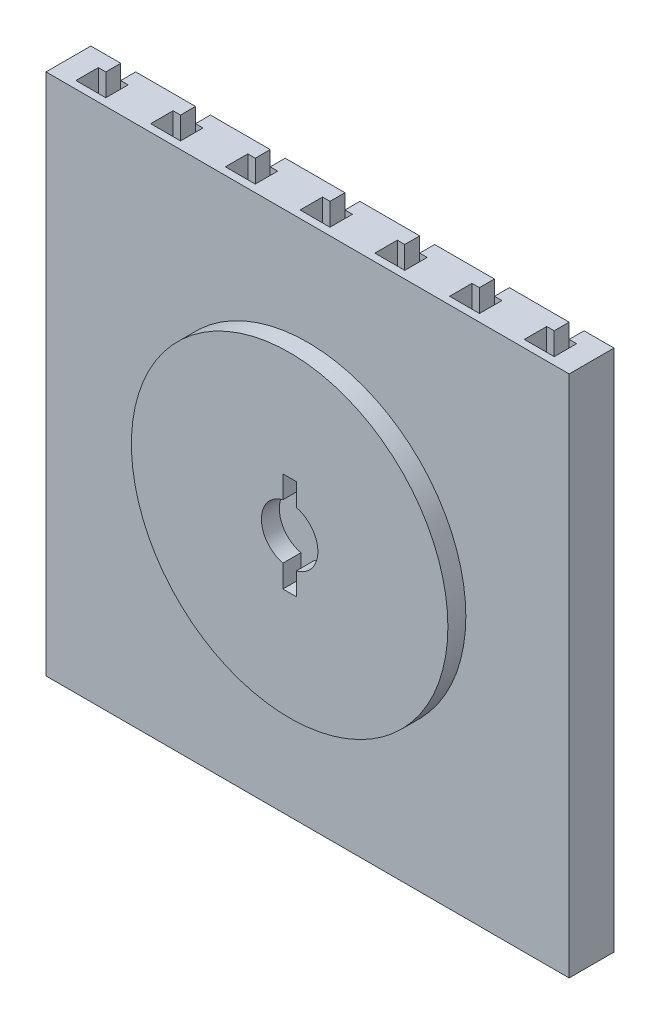
from build123d import *

# Parameters (mm, degrees)
SKETCH1_W           = 350
SKETCH1_H           = 350
BOSS_EXTRUDE1_DEPTH = 30
SKETCH2_R           = 105.873487711
BOSS_EXTRUDE2_DEPTH = 12
CUT_EXTRUDE1_DEPTH  = 12
CUT_EXTRUDE3_DEPTH  = 394.559398312


with BuildPart() as part:
    # Sketch1 → Boss-Extrude1 (new body)
    with BuildSketch(Plane.XY):
        Rectangle(SKETCH1_W, SKETCH1_H)
    extrude(amount=BOSS_EXTRUDE1_DEPTH)

    # Sketch2 → Boss-Extrude2 (add)
    with BuildSketch(Plane.XY.offset(30)):
        Circle(SKETCH2_R)
    extrude(amount=BOSS_EXTRUDE2_DEPTH)

    # Sketch3 → Cut-Extrude1 (cut)
    with BuildSketch(Plane.XY.offset(42)):
        with BuildLine():
            Line((-4.5, 18.356470249), (-4.5, 33.356470249))
            Line((-4.5, 33.356470249), (4.5, 33.356470249))
            Line((4.5, 33.356470249), (4.5, 18.356470249))
            ThreePointArc((4.5, 18.356470249), (18.9, 0), (4.5, -18.356470249))
            Line((4.5, -18.356470249), (4.5, -33.356470249))
            Line((4.5, -33.356470249), (-4.5, -33.356470249))
            Line((-4.5, -33.356470249), (-4.5, -18.356470249))
            ThreePointArc((-4.5, -18.356470249), (-18.9, 0), (-4.5, 18.356470249))
        make_face()
    extrude(amount=-CUT_EXTRUDE1_DEPTH, mode=Mode.SUBTRACT)

    # Sketch5 → Cut-Extrude3 (cut, through all)
    with BuildSketch(Plane(origin=(0, 175, 0), x_dir=(1, 0, 0), z_dir=(0, 1, 0))):
        Polygon((-145, 0), (-155, 0), (-155, -10), (-160, -10), (-160, -25), (-140, -25), (-140, -10), (-145, -10), align=None)
        Polygon((-95, 0), (-105, 0), (-105, -10), (-110, -10), (-110, -25), (-90, -25), (-90, -10), (-95, -10), align=None)
        Polygon((-45, 0), (-55, 0), (-55, -10), (-60, -10), (-60, -25), (-40, -25), (-40, -10), (-45, -10), align=None)
        Polygon((5, 0), (-5, 0), (-5, -10), (-10, -10), (-10, -25), (10, -25), (10, -10), (5, -10), align=None)
        Polygon((55, 0), (45, 0), (45, -10), (40, -10), (40, -25), (60, -25), (60, -10), (55, -10), align=None)
        Polygon((105, 0), (95, 0), (95, -10), (90, -10), (90, -25), (110, -25), (110, -10), (105, -10), align=None)
        Polygon((155, 0), (145, 0), (145, -10), (140, -10), (140, -25), (160, -25), (160, -10), (155, -10), align=None)
    extrude(amount=-CUT_EXTRUDE3_DEPTH, mode=Mode.SUBTRACT)


solid = part.part
